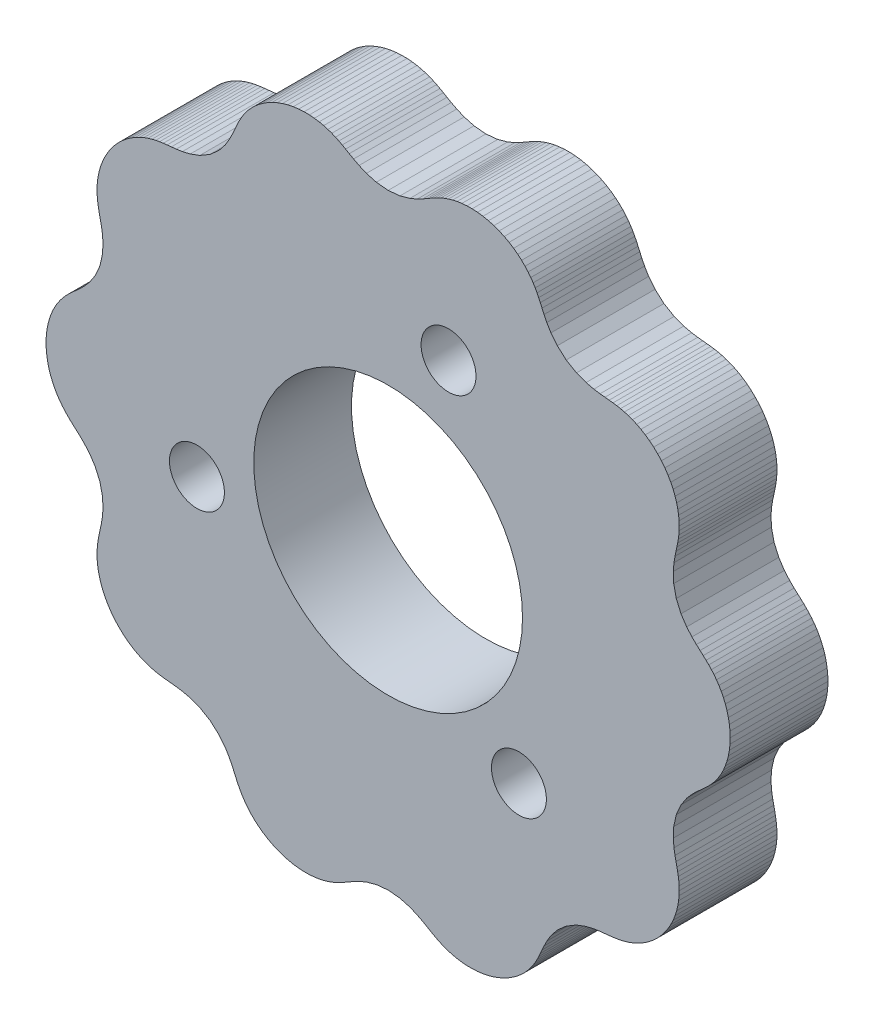
from build123d import *

# Parameters (mm, degrees)
MODEL_R             = 8.73125
BOSS_EXTRUDE1_DEPTH = 6.35
SKETCH2_R           = 1.78435
CUT_EXTRUDE1_DEPTH  = 33.394174877
SKETCH3_R           = 3.175
CUT_EXTRUDE2_DEPTH  = 3.81


with BuildPart() as part:
    # Model → Boss-Extrude1 (new body)
    with BuildSketch(Plane.XY):
        Polygon((20.941629201, -0.364963193), (20.955, 0), (20.941629201, 0.364963193), (20.901922637, 0.725339271), (20.837077689, 1.076721058), (20.749022936, 1.415056537), (20.640317487, 1.736815019), (20.514009501, 2.039140817), (20.373452436, 2.319992472), (20.222075603, 2.578268118), (20.063102261, 2.813921856), (19.899202936, 3.02808351), (19.732063434, 3.223207951), (19.561836494, 3.403306388), (19.386438749, 3.57436298), (19.200674898, 3.74513778), (18.995306485, 3.928728031), (18.756713032, 4.145460185), (18.469436892, 4.427379559), (18.12743825, 4.821248722), (17.760193418, 5.374895049), (17.451547523, 6.082999534), (17.285033924, 6.837285602), (17.256716088, 7.501055986), (17.301888316, 8.02072459), (17.368591545, 8.417658833), (17.434225739, 8.733240541), (17.492460634, 9.002480699), (17.542367837, 9.249829667), (17.583723052, 9.491313564), (17.615580334, 9.737073145), (17.636107763, 9.993174268), (17.64282404, 10.262772292), (17.632922383, 10.546862357), (17.603578198, 10.844788814), (17.552210791, 11.154619946), (17.476693453, 11.473448626), (17.375513119, 11.797652166), (17.247882306, 12.123128603), (17.093805938, 12.445517344), (16.914105479, 12.760406648), (16.7104027, 13.063527232), (16.485065514, 13.350929499), (16.241118485, 13.619140938), (15.982120788, 13.865299872), (15.712014392, 14.087261738), (15.434944945, 14.283674358), (15.155056992, 14.454019095), (14.876263477, 14.598615487), (14.601986431, 14.718587804), (14.334860504, 14.815793497), (14.076382102, 14.892716309), (13.826472136, 14.952333163), (13.582896444, 14.997978975), (13.340452145, 15.033270456), (13.089787123, 15.06224092), (12.815728945, 15.090056029), (12.495310823, 15.125154311), (12.097191494, 15.184375197), (11.588998295, 15.302000286), (10.966465839, 15.534048477), (10.300552691, 15.925499534), (9.722482133, 16.437855544), (9.309418081, 16.958212258), (9.040509639, 17.40518456), (8.86116159, 17.765518282), (8.728766495, 18.059408059), (8.61762412, 18.311457534), (8.51261182, 18.540901771), (8.404128218, 18.760574333), (8.285447444, 18.978123251), (8.151522019, 19.197379132), (7.998489859, 19.419436244), (7.8234953, 19.643449886), (7.624638577, 19.867229373), (7.400967303, 20.087695021), (7.152469697, 20.301244863), (6.880051027, 20.504058728), (6.585485281, 20.692355188), (6.271339533, 20.862609342), (5.940871519, 21.01173486), (5.5979027, 21.137231075), (5.246670273, 21.237294518), (4.891662253, 21.310893665), (4.537440123, 21.357805398), (4.188453547, 21.378611764), (3.848851214, 21.374655577), (3.52229098, 21.347953353), (3.211750662, 21.301063574), (2.919337911, 21.236907215), (2.646092424, 21.158535592), (2.39176491, 21.068837662), (2.154541592, 20.970175318), (1.930654783, 20.863933355), (1.713769413, 20.749979581), (1.493948739, 20.626079975), (1.255881705, 20.487495515), (0.976027746, 20.327553575), (0.619133279, 20.141455608), (0.138858053, 19.937907837), (-0.501175788, 19.75972337), (-1.27, 19.685), (-2.038824212, 19.75972337), (-2.678858053, 19.937907837), (-3.159133279, 20.141455608), (-3.516027746, 20.327553575), (-3.795881705, 20.487495515), (-4.033948739, 20.626079975), (-4.253769413, 20.749979581), (-4.470654783, 20.863933355), (-4.694541592, 20.970175318), (-4.93176491, 21.068837662), (-5.186092424, 21.158535592), (-5.459337911, 21.236907215), (-5.751750662, 21.301063574), (-6.06229098, 21.347953353), (-6.388851214, 21.374655577), (-6.728453547, 21.378611764), (-7.077440123, 21.357805398), (-7.431662253, 21.310893665), (-7.786670273, 21.237294518), (-8.1379027, 21.137231075), (-8.480871519, 21.01173486), (-8.811339533, 20.862609342), (-9.125485281, 20.692355188), (-9.420051027, 20.504058728), (-9.692469697, 20.301244863), (-9.940967303, 20.087695021), (-10.164638577, 19.867229373), (-10.3634953, 19.643449886), (-10.538489859, 19.419436244), (-10.691522019, 19.197379132), (-10.825447444, 18.978123251), (-10.944128218, 18.760574333), (-11.05261182, 18.540901771), (-11.15762412, 18.311457534), (-11.268766495, 18.059408059), (-11.40116159, 17.765518282), (-11.580509639, 17.40518456), (-11.849418081, 16.958212258), (-12.262482133, 16.437855544), (-12.840552691, 15.925499534), (-13.506465839, 15.534048477), (-14.128998295, 15.302000286), (-14.637191494, 15.184375197), (-15.035310823, 15.125154311), (-15.355728945, 15.090056029), (-15.629787123, 15.06224092), (-15.880452145, 15.033270456), (-16.122896444, 14.997978975), (-16.366472136, 14.952333163), (-16.616382102, 14.892716309), (-16.874860504, 14.815793497), (-17.141986431, 14.718587804), (-17.416263477, 14.598615487), (-17.695056992, 14.454019095), (-17.974944945, 14.283674358), (-18.252014392, 14.087261738), (-18.522120788, 13.865299872), (-18.781118485, 13.619140938), (-19.025065514, 13.350929499), (-19.2504027, 13.063527232), (-19.454105479, 12.760406648), (-19.633805938, 12.445517344), (-19.787882306, 12.123128603), (-19.915513119, 11.797652166), (-20.016693453, 11.473448626), (-20.092210791, 11.154619946), (-20.143578198, 10.844788814), (-20.172922383, 10.546862357), (-20.18282404, 10.262772292), (-20.176107763, 9.993174268), (-20.155580334, 9.737073145), (-20.123723052, 9.491313564), (-20.082367837, 9.249829667), (-20.032460634, 9.002480699), (-19.974225739, 8.733240541), (-19.908591545, 8.417658833), (-19.841888316, 8.02072459), (-19.796716088, 7.501055986), (-19.825033924, 6.837285602), (-19.991547523, 6.082999534), (-20.300193418, 5.374895049), (-20.66743825, 4.821248722), (-21.009436892, 4.427379559), (-21.296713032, 4.145460185), (-21.535306485, 3.928728031), (-21.740674898, 3.74513778), (-21.926438749, 3.57436298), (-22.101836494, 3.403306388), (-22.272063434, 3.223207951), (-22.439202936, 3.02808351), (-22.603102261, 2.813921856), (-22.762075603, 2.578268118), (-22.913452436, 2.319992472), (-23.054009501, 2.039140817), (-23.180317487, 1.736815019), (-23.289022936, 1.415056537), (-23.377077689, 1.076721058), (-23.441922637, 0.725339271), (-23.481629201, 0.364963193), (-23.495, 0), (-23.481629201, -0.364963193), (-23.441922637, -0.725339271), (-23.377077689, -1.076721058), (-23.289022936, -1.415056537), (-23.180317487, -1.736815019), (-23.054009501, -2.039140817), (-22.913452436, -2.319992472), (-22.762075603, -2.578268118), (-22.603102261, -2.813921856), (-22.439202936, -3.02808351), (-22.272063434, -3.223207951), (-22.101836494, -3.403306388), (-21.926438749, -3.57436298), (-21.740674898, -3.74513778), (-21.535306485, -3.928728031), (-21.296713032, -4.145460185), (-21.009436892, -4.427379559), (-20.66743825, -4.821248722), (-20.300193418, -5.374895049), (-19.991547523, -6.082999534), (-19.825033924, -6.837285602), (-19.796716088, -7.501055986), (-19.841888316, -8.02072459), (-19.908591545, -8.417658833), (-19.974225739, -8.733240541), (-20.032460634, -9.002480699), (-20.082367837, -9.249829667), (-20.123723052, -9.491313564), (-20.155580334, -9.737073145), (-20.176107763, -9.993174268), (-20.18282404, -10.262772292), (-20.172922383, -10.546862357), (-20.143578198, -10.844788814), (-20.092210791, -11.154619946), (-20.016693453, -11.473448626), (-19.915513119, -11.797652166), (-19.787882306, -12.123128603), (-19.633805938, -12.445517344), (-19.454105479, -12.760406648), (-19.2504027, -13.063527232), (-19.025065514, -13.350929499), (-18.781118485, -13.619140938), (-18.522120788, -13.865299872), (-18.252014392, -14.087261738), (-17.974944945, -14.283674358), (-17.695056992, -14.454019095), (-17.416263477, -14.598615487), (-17.141986431, -14.718587804), (-16.874860504, -14.815793497), (-16.616382102, -14.892716309), (-16.366472136, -14.952333163), (-16.122896444, -14.997978975), (-15.880452145, -15.033270456), (-15.629787123, -15.06224092), (-15.355728945, -15.090056029), (-15.035310823, -15.125154311), (-14.637191494, -15.184375197), (-14.128998295, -15.302000286), (-13.506465839, -15.534048477), (-12.840552691, -15.925499534), (-12.262482133, -16.437855544), (-11.849418081, -16.958212258), (-11.580509639, -17.40518456), (-11.40116159, -17.765518282), (-11.268766495, -18.059408059), (-11.15762412, -18.311457534), (-11.05261182, -18.540901771), (-10.944128218, -18.760574333), (-10.825447444, -18.978123251), (-10.691522019, -19.197379132), (-10.538489859, -19.419436244), (-10.3634953, -19.643449886), (-10.164638577, -19.867229373), (-9.940967303, -20.087695021), (-9.692469697, -20.301244863), (-9.420051027, -20.504058728), (-9.125485281, -20.692355188), (-8.811339533, -20.862609342), (-8.480871519, -21.01173486), (-8.1379027, -21.137231075), (-7.786670273, -21.237294518), (-7.431662253, -21.310893665), (-7.077440123, -21.357805398), (-6.728453547, -21.378611764), (-6.388851214, -21.374655577), (-6.06229098, -21.347953353), (-5.751750662, -21.301063574), (-5.459337911, -21.236907215), (-5.186092424, -21.158535592), (-4.93176491, -21.068837662), (-4.694541592, -20.970175318), (-4.470654783, -20.863933355), (-4.253769413, -20.749979581), (-4.033948739, -20.626079975), (-3.795881705, -20.487495515), (-3.516027746, -20.327553575), (-3.159133279, -20.141455608), (-2.678858053, -19.937907837), (-2.038824212, -19.75972337), (-1.27, -19.685), (-0.501175788, -19.75972337), (0.138858053, -19.937907837), (0.619133279, -20.141455608), (0.976027746, -20.327553575), (1.255881705, -20.487495515), (1.493948739, -20.626079975), (1.713769413, -20.749979581), (1.930654783, -20.863933355), (2.154541592, -20.970175318), (2.39176491, -21.068837662), (2.646092424, -21.158535592), (2.919337911, -21.236907215), (3.211750662, -21.301063574), (3.52229098, -21.347953353), (3.848851214, -21.374655577), (4.188453547, -21.378611764), (4.537440123, -21.357805398), (4.891662253, -21.310893665), (5.246670273, -21.237294518), (5.5979027, -21.137231075), (5.940871519, -21.01173486), (6.271339533, -20.862609342), (6.585485281, -20.692355188), (6.880051027, -20.504058728), (7.152469697, -20.301244863), (7.400967303, -20.087695021), (7.624638577, -19.867229373), (7.8234953, -19.643449886), (7.998489859, -19.419436244), (8.151522019, -19.197379132), (8.285447444, -18.978123251), (8.404128218, -18.760574333), (8.51261182, -18.540901771), (8.61762412, -18.311457534), (8.728766495, -18.059408059), (8.86116159, -17.765518282), (9.040509639, -17.40518456), (9.309418081, -16.958212258), (9.722482133, -16.437855544), (10.300552691, -15.925499534), (10.966465839, -15.534048477), (11.588998295, -15.302000286), (12.097191494, -15.184375197), (12.495310823, -15.125154311), (12.815728945, -15.090056029), (13.089787123, -15.06224092), (13.340452145, -15.033270456), (13.582896444, -14.997978975), (13.826472136, -14.952333163), (14.076382102, -14.892716309), (14.334860504, -14.815793497), (14.601986431, -14.718587804), (14.876263477, -14.598615487), (15.155056992, -14.454019095), (15.434944945, -14.283674358), (15.712014392, -14.087261738), (15.982120788, -13.865299872), (16.241118485, -13.619140938), (16.485065514, -13.350929499), (16.7104027, -13.063527232), (16.914105479, -12.760406648), (17.093805938, -12.445517344), (17.247882306, -12.123128603), (17.375513119, -11.797652166), (17.476693453, -11.473448626), (17.552210791, -11.154619946), (17.603578198, -10.844788814), (17.632922383, -10.546862357), (17.64282404, -10.262772292), (17.636107763, -9.993174268), (17.615580334, -9.737073145), (17.583723052, -9.491313564), (17.542367837, -9.249829667), (17.492460634, -9.002480699), (17.434225739, -8.733240541), (17.368591545, -8.417658833), (17.301888316, -8.02072459), (17.256716088, -7.501055986), (17.285033924, -6.837285602), (17.451547523, -6.082999534), (17.760193418, -5.374895049), (18.12743825, -4.821248722), (18.469436892, -4.427379559), (18.756713032, -4.145460185), (18.995306485, -3.928728031), (19.200674898, -3.74513778), (19.386438749, -3.57436298), (19.561836494, -3.403306388), (19.732063434, -3.223207951), (19.899202936, -3.02808351), (20.063102261, -2.813921856), (20.222075603, -2.578268118), (20.373452436, -2.319992472), (20.514009501, -2.039140817), (20.640317487, -1.736815019), (20.749022936, -1.415056537), (20.837077689, -1.076721058), (20.901922637, -0.725339271), align=None)
        with Locations((-1.27, 0)):
            Circle(MODEL_R, mode=Mode.SUBTRACT)
    extrude(amount=BOSS_EXTRUDE1_DEPTH)

    # Sketch2 → Cut-Extrude1 (cut, through all)
    with BuildSketch(Plane.XY):
        with Locations((2.654515829, 12.078417757)):
            Circle(SKETCH2_R)
        with Locations((7.227958701, -9.437939284)):
            Circle(SKETCH2_R)
        with Locations((-13.692474529, -2.640478473)):
            Circle(SKETCH2_R)
    extrude(amount=CUT_EXTRUDE1_DEPTH, mode=Mode.SUBTRACT)

    # Sketch3 → Cut-Extrude2 (cut)
    with BuildSketch(Plane(origin=(0, 0, 0), x_dir=(-1, 0, 0), z_dir=(0, 0, -1))):
        with Locations((-2.654515829, 12.078417757)):
            Circle(SKETCH3_R)
        with Locations((13.692474529, -2.640478473)):
            Circle(SKETCH3_R)
        with Locations((-7.227958701, -9.437939284)):
            Circle(SKETCH3_R)
    extrude(amount=-CUT_EXTRUDE2_DEPTH, mode=Mode.SUBTRACT)


solid = part.part
